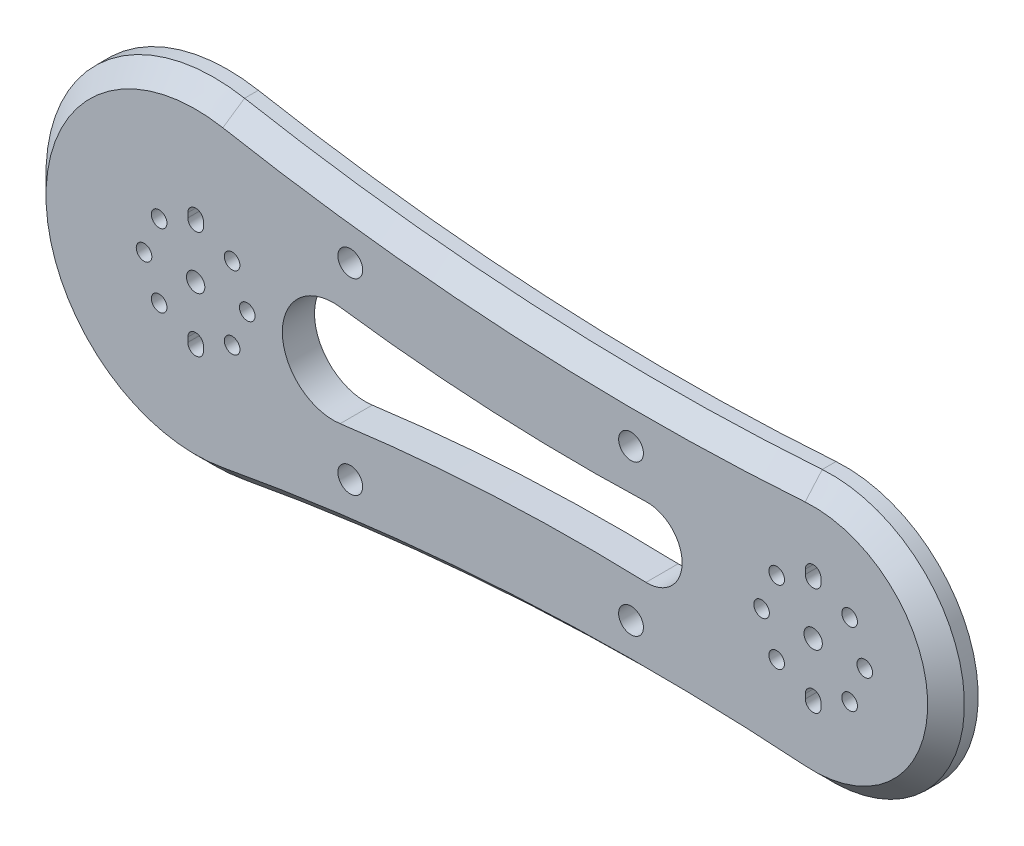
from build123d import *

# Parameters (mm, degrees)
SKETCH1_R           = 1.7
BOSS_EXTRUDE1_DEPTH = 7
CHAMFER1_SIZE       = 4
CUT_EXTRUDE2_DEPTH  = 23
SKETCH4_R           = 2.7
CUT_EXTRUDE3_DEPTH  = 37
SKETCH5_R           = 1.7
CUT_EXTRUDE4_DEPTH  = 29.5
BOSS_EXTRUDE2_START = -7
SKETCH6_R           = 1.7
BOSS_EXTRUDE2_DEPTH = 7
SKETCH7_R           = 1.7
CUT_EXTRUDE5_DEPTH  = 29.5
CUT_EXTRUDE6_START  = -10
SKETCH9_R           = 1.7
CUT_EXTRUDE6_DEPTH  = 10


with BuildPart() as part:
    # Sketch1 → Boss-Extrude1 (new body)
    # profile 1 of 2: a face of its own
    with BuildSketch(Plane.XY):
        with BuildLine():
            ThreePointArc((151.975863937, 0), (153.975863937, 2), (155.975863937, 0))
            Line((155.975863937, 0), (182.913605213, 0))
            ThreePointArc((182.913605213, 0), (173.710575573, 21.164451961), (151.955140105, 28.867101437))
            ThreePointArc((151.955140105, 28.867101437), (88.828026104, 28.443109388), (26.150636783, 35.976844134))
            ThreePointArc((26.150636783, 35.976844134), (-3.901297619, 28.123718694), (-17.086394787, 0))
            Line((-17.086394787, 0), (10.8, 0))
            ThreePointArc((10.8, 0), (12.5, 1.7), (14.2, 0))
            Line((14.2, 0), (17.5, 0))
            ThreePointArc((17.5, 0), (19.5, 2), (21.5, 0))
            Line((21.5, 0), (24.8, 0))
            ThreePointArc((24.8, 0), (26.5, 1.7), (28.2, 0))
            Line((28.2, 0), (151.975863937, 0))
        make_face()
        with Locations((19.5, 7)):
            Circle(SKETCH1_R, mode=Mode.SUBTRACT)
    # profile 2 of 2: a face of its own
    with BuildSketch(Plane.XY):
        with BuildLine():
            Line((182.913605213, 0), (155.975863937, 0))
            ThreePointArc((155.975863937, 0), (153.975863937, -2), (151.975863937, 0))
            Line((151.975863937, 0), (28.2, 0))
            ThreePointArc((28.2, 0), (26.5, -1.7), (24.8, 0))
            Line((24.8, 0), (21.5, 0))
            ThreePointArc((21.5, 0), (19.5, -2), (17.5, 0))
            Line((17.5, 0), (14.2, 0))
            ThreePointArc((14.2, 0), (12.5, -1.7), (10.8, 0))
            Line((10.8, 0), (-17.086394787, 0))
            ThreePointArc((-17.086394787, 0), (-3.901297619, -28.123718694), (26.150636783, -35.976844134))
            ThreePointArc((26.150636783, -35.976844134), (88.828026104, -28.443109388), (151.955140105, -28.867101437))
            ThreePointArc((151.955140105, -28.867101437), (173.710575573, -21.164451961), (182.913605213, 0))
        make_face()
        with Locations((19.5, -7)):
            Circle(SKETCH1_R, mode=Mode.SUBTRACT)
    extrude(amount=BOSS_EXTRUDE1_DEPTH)

    # Chamfer1
    chamfer1_edges = [part.edges().sort_by_distance(p)[0] for p in [
        (88.828026104, -28.443109388, 7),
        (182.913605213, 0, 7),
        (88.828026104, 28.443109388, 7),
        (-17.086394787, 0, 7),
    ]]
    chamfer(chamfer1_edges, length=CHAMFER1_SIZE)

    # Sketch3 → Cut-Extrude2 (cut)
    with BuildSketch(Plane.XY.offset(7)):
        with BuildLine():
            ThreePointArc((50.964034346, 10.98772537), (38.385340354, 0), (50.964034346, -10.98772537))
            ThreePointArc((50.964034346, -10.98772537), (84.198470815, -7.896690537), (117.575110316, -7.609986123))
            ThreePointArc((117.575110316, -7.609986123), (125.444284006, 0), (117.575110316, 7.609986123))
            ThreePointArc((117.575110316, 7.609986123), (84.198470815, 7.896690537), (50.964034346, 10.98772537))
        make_face()
    extrude(amount=-CUT_EXTRUDE2_DEPTH, mode=Mode.SUBTRACT)

    # Sketch4 → Cut-Extrude3 (cut)
    with BuildSketch(Plane(origin=(0, 0, 0), x_dir=(-1, 0, 0), z_dir=(0, 0, -1))):
        with Locations((-114.313426319, 16.420760727)):
            Circle(SKETCH4_R)
        with Locations((-53.177713255, 20.434899892)):
            Circle(SKETCH4_R)
        with Locations((-114.313426318, -16.420760733)):
            Circle(SKETCH4_R)
        with Locations((-53.177713253, -20.434899892)):
            Circle(SKETCH4_R)
    extrude(amount=-CUT_EXTRUDE3_DEPTH, mode=Mode.SUBTRACT)

    # Sketch5 → Cut-Extrude4 (cut)
    with BuildSketch(Plane(origin=(0, 0, 0), x_dir=(-1, 0, 0), z_dir=(0, 0, -1))):
        with Locations((-19.499999999, -11.235000001)):
            Circle(SKETCH5_R)
        with Locations((-11.555655313, -7.944344687)):
            Circle(SKETCH5_R)
        with Locations((-8.265, -1e-09)):
            Circle(SKETCH5_R)
        with Locations((-11.555655314, 7.944344686)):
            Circle(SKETCH5_R)
        with Locations((-19.500000001, 11.234999999)):
            Circle(SKETCH5_R)
        with Locations((-27.444344687, 7.944344685)):
            Circle(SKETCH5_R)
        with Locations((-30.735, -2e-09)):
            Circle(SKETCH5_R)
        with Locations((-27.444344686, -7.944344688)):
            Circle(SKETCH5_R)
    extrude(amount=-CUT_EXTRUDE4_DEPTH, mode=Mode.SUBTRACT)

    # Sketch6 → Boss-Extrude2 (add)
    with BuildSketch(Plane.XY.offset(7).offset(BOSS_EXTRUDE2_START)):
        with Locations((19.5, 7)):
            Circle(SKETCH6_R)
        with Locations((26.5, 0)):
            Circle(SKETCH6_R)
        with Locations((19.5, -7)):
            Circle(SKETCH6_R)
        with Locations((12.5, 0)):
            Circle(SKETCH6_R)
    extrude(amount=BOSS_EXTRUDE2_DEPTH)

    # Sketch7 → Cut-Extrude5 (cut)
    with BuildSketch(Plane(origin=(0, 0, 0), x_dir=(-1, 0, 0), z_dir=(0, 0, -1))):
        with Locations((-146.03151925, -7.944344686)):
            Circle(SKETCH7_R)
        with Locations((-153.975863936, -11.235)):
            Circle(SKETCH7_R)
        with Locations((-161.920208623, -7.944344687)):
            Circle(SKETCH7_R)
        with Locations((-165.210863937, -1e-09)):
            Circle(SKETCH7_R)
        with Locations((-161.920208624, 7.944344686)):
            Circle(SKETCH7_R)
        with Locations((-153.975863937, 11.235)):
            Circle(SKETCH7_R)
        with Locations((-146.031519251, 7.944344687)):
            Circle(SKETCH7_R)
        with Locations((-142.740863937, 1e-09)):
            Circle(SKETCH7_R)
    extrude(amount=-CUT_EXTRUDE5_DEPTH, mode=Mode.SUBTRACT)

    # Sketch9 → Cut-Extrude6 (cut)
    with BuildSketch(Plane.XY.offset(7).offset(CUT_EXTRUDE6_START)):
        with BuildLine():
            Line((152.275863937, 12.235), (152.275863937, 11.235))
            ThreePointArc((152.275863937, 11.235), (153.975863937, 12.935), (155.675863937, 11.235))
            Line((155.675863937, 11.235), (155.675863937, 12.235))
            ThreePointArc((155.675863937, 12.235), (153.975863937, 13.935), (152.275863937, 12.235))
        make_face()
        with Locations((153.975863937, 11.235)):
            Circle(SKETCH9_R)
        with BuildLine():
            Line((155.675863936, -12.235), (155.675863936, -11.235))
            ThreePointArc((155.675863936, -11.235), (153.975863936, -12.935), (152.275863936, -11.235))
            Line((152.275863939, -11.235), (152.275863939, -12.235))
            ThreePointArc((152.275863939, -12.235), (153.975863937, -13.934999999), (155.675863936, -12.235))
        make_face()
        with Locations((153.975863936, -11.235)):
            Circle(SKETCH9_R)
        with BuildLine():
            ThreePointArc((17.800000001, 11.235), (19.500000001, 12.934999999), (21.200000001, 11.234999999))
            Line((21.199999999, 11.235), (21.199999999, 12.235))
            ThreePointArc((21.199999999, 12.235), (19.499999999, 13.935), (17.799999999, 12.235))
            Line((17.799999999, 12.235), (17.799999999, 11.235))
        make_face()
        with Locations((19.500000001, 11.234999999)):
            Circle(SKETCH9_R)
        with Locations((19.499999999, -11.235000001)):
            Circle(SKETCH9_R)
        with BuildLine():
            ThreePointArc((21.199999999, -11.235000001), (19.499999999, -12.935000001), (17.799999999, -11.235))
            Line((17.800000001, -11.235), (17.800000001, -12.235))
            ThreePointArc((17.800000001, -12.235), (19.499999999, -13.934999999), (21.199999998, -12.235))
            Line((21.199999998, -12.235), (21.199999998, -11.235))
        make_face()
    extrude(amount=CUT_EXTRUDE6_DEPTH, mode=Mode.SUBTRACT)


solid = part.part
